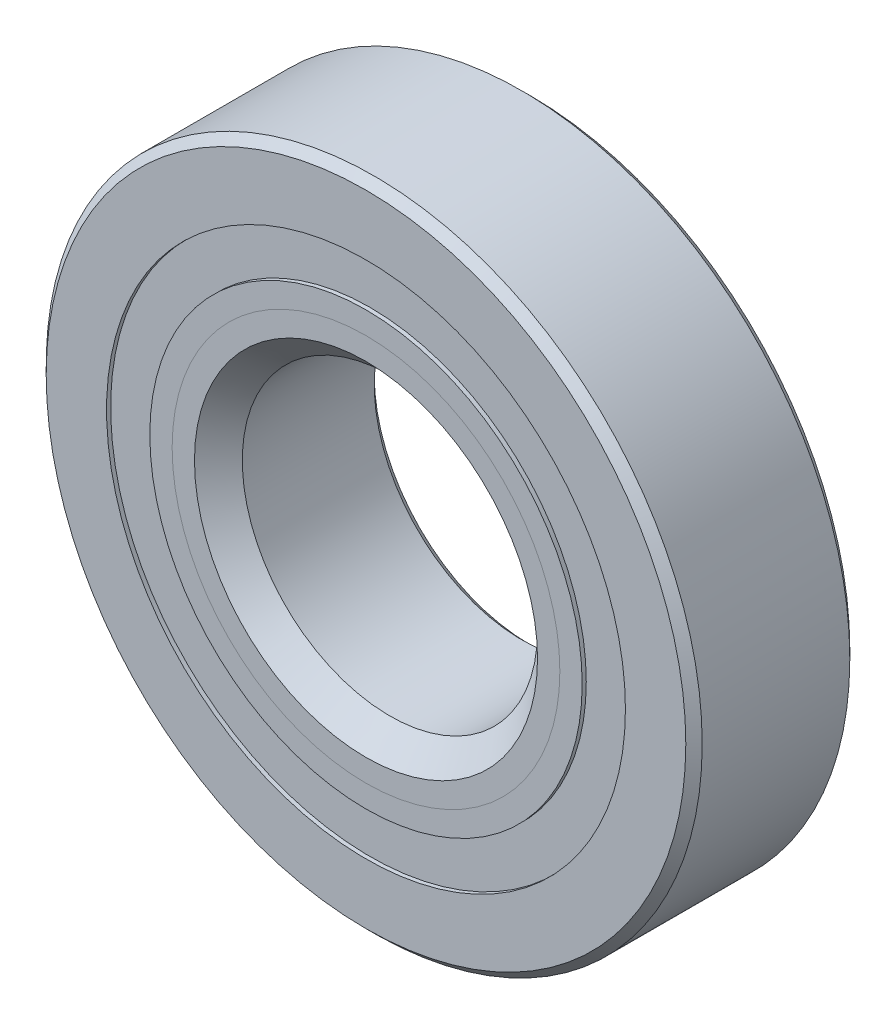
from build123d import *

# Parameters (mm, degrees)
CIRPATTERN1_COUNT = 12
SKETCH5_W         = 3.438483216
SKETCH5_H         = 4.186813186


with BuildPart() as part:
    # Sketch1 → Revolve1 (revolve)
    with BuildSketch(Plane(origin=(0, 0, 0), x_dir=(0, 0, -1), z_dir=(1, 0, 0))):
        with BuildLine():
            Line((7.14375, 31.75), (-7.14375, 31.75))
            Line((-7.14375, 31.75), (-7.9375, 30.95625))
            Line((-7.9375, 30.95625), (-7.9375, 25.112156593))
            Line((-7.9375, 25.112156593), (-3.527777778, 25.112156593))
            ThreePointArc((-3.527777778, 25.112156593), (0, 27.120891784), (3.527777778, 25.112156593))
            Line((3.527777778, 25.112156593), (7.9375, 25.112156593))
            Line((7.9375, 25.112156593), (7.9375, 30.95625))
            Line((7.9375, 30.95625), (7.14375, 31.75))
        make_face()
    revolve(axis=Axis((0, 0, 7.9375), (0, 0, -1)))


with BuildPart() as body_2:
    # Sketch2 → Revolve2 (revolve)
    with BuildSketch(Plane(origin=(0, 0, 0), x_dir=(0, 0, -1), z_dir=(1, 0, 0))):
        with BuildLine():
            Line((-7.9375, 20.925343407), (-3.527777778, 20.925343407))
            ThreePointArc((-3.527777778, 20.925343407), (-2.029792669, 19.45399069), (0, 18.916608216))
            Line((0, 18.916608216), (0, 16.602054108))
            Line((0, 16.602054108), (-5.775855351, 16.602054108))
            Line((-5.775855351, 16.602054108), (-7.9375, 18.763698757))
            Line((-7.9375, 18.763698757), (-7.9375, 20.925343407))
        make_face()
    revolve(axis=Axis((0, 0, 7.9375), (0, 0, -1)))


with BuildPart() as body_3:
    # Sketch3 → Revolve3 (revolve)
    with BuildSketch(Plane(origin=(0, 0, 0), x_dir=(0, 0, -1), z_dir=(1, 0, 0))):
        with BuildLine():
            Line((-7.9375, 18.763698757), (-5.775855351, 16.602054108))
            Line((-5.775855351, 16.602054108), (0, 16.602054108))
            Line((0, 16.602054108), (0, 18.916608216))
            ThreePointArc((0, 18.916608216), (2.029792669, 19.45399069), (3.527777778, 20.925343407))
            Line((3.527777778, 20.925343407), (7.9375, 20.925343407))
            Line((7.9375, 20.925343407), (7.9375, 15.08125))
            Line((7.9375, 15.08125), (7.14375, 14.2875))
            Line((7.14375, 14.2875), (-5.622945892, 14.2875))
            Line((-5.622945892, 14.2875), (-7.9375, 16.602054108))
            Line((-7.9375, 16.602054108), (-7.9375, 18.763698757))
        make_face()
    revolve(axis=Axis((0, 0, 7.9375), (0, 0, -1)))


with BuildPart() as body_4:
    # Sketch4 → Revolve4 (revolve)
    with BuildSketch(Plane(origin=(0, 0, 0), x_dir=(0, 0, -1), z_dir=(1, 0, 0))):
        with BuildLine():
            Line((-4.102141784, 23.01875), (4.102141784, 23.01875))
            ThreePointArc((4.102141784, 23.01875), (0, 27.120891784), (-4.102141784, 23.01875))
        make_face()
    revolve(axis=Axis((0, 23.01875, 4.102141784), (0, 0, -1)))


with BuildPart() as cirpattern1_1:
    # CirPattern1: pattern copy
    add(body_4.part.rotate(Axis((0, 0, -7.9375), (0, 0, 1)), 1 * 360 / CIRPATTERN1_COUNT))


with BuildPart() as cirpattern1_2:
    # CirPattern1: pattern copy
    add(body_4.part.rotate(Axis((0, 0, -7.9375), (0, 0, 1)), 2 * 360 / CIRPATTERN1_COUNT))


with BuildPart() as cirpattern1_3:
    # CirPattern1: pattern copy
    add(body_4.part.rotate(Axis((0, 0, -7.9375), (0, 0, 1)), 3 * 360 / CIRPATTERN1_COUNT))


with BuildPart() as cirpattern1_4:
    # CirPattern1: pattern copy
    add(body_4.part.rotate(Axis((0, 0, -7.9375), (0, 0, 1)), 4 * 360 / CIRPATTERN1_COUNT))


with BuildPart() as cirpattern1_5:
    # CirPattern1: pattern copy
    add(body_4.part.rotate(Axis((0, 0, -7.9375), (0, 0, 1)), 5 * 360 / CIRPATTERN1_COUNT))


with BuildPart() as cirpattern1_6:
    # CirPattern1: pattern copy
    add(body_4.part.rotate(Axis((0, 0, -7.9375), (0, 0, 1)), 6 * 360 / CIRPATTERN1_COUNT))


with BuildPart() as cirpattern1_7:
    # CirPattern1: pattern copy
    add(body_4.part.rotate(Axis((0, 0, -7.9375), (0, 0, 1)), 7 * 360 / CIRPATTERN1_COUNT))


with BuildPart() as cirpattern1_8:
    # CirPattern1: pattern copy
    add(body_4.part.rotate(Axis((0, 0, -7.9375), (0, 0, 1)), 8 * 360 / CIRPATTERN1_COUNT))


with BuildPart() as cirpattern1_9:
    # CirPattern1: pattern copy
    add(body_4.part.rotate(Axis((0, 0, -7.9375), (0, 0, 1)), 9 * 360 / CIRPATTERN1_COUNT))


with BuildPart() as cirpattern1_10:
    # CirPattern1: pattern copy
    add(body_4.part.rotate(Axis((0, 0, -7.9375), (0, 0, 1)), 10 * 360 / CIRPATTERN1_COUNT))


with BuildPart() as cirpattern1_11:
    # CirPattern1: pattern copy
    add(body_4.part.rotate(Axis((0, 0, -7.9375), (0, 0, 1)), 11 * 360 / CIRPATTERN1_COUNT))


with BuildPart() as body_16:
    # Sketch5 → Revolve5 (revolve)
    with BuildSketch(Plane(origin=(0, 0, 0), x_dir=(0, 0, -1), z_dir=(1, 0, 0))):
        with Locations((-5.821383392, 23.01875)):
            Rectangle(SKETCH5_W, SKETCH5_H)
        with Locations((5.821383392, 23.01875)):
            Rectangle(SKETCH5_W, SKETCH5_H)
    revolve(axis=Axis((0, 0, 7.9375), (0, 0, -1)))


solid = Compound([part.part, body_2.part, body_3.part, body_4.part, cirpattern1_1.part, cirpattern1_2.part, cirpattern1_3.part, cirpattern1_4.part, cirpattern1_5.part, cirpattern1_6.part, cirpattern1_7.part, cirpattern1_8.part, cirpattern1_9.part, cirpattern1_10.part, cirpattern1_11.part, body_16.part])
